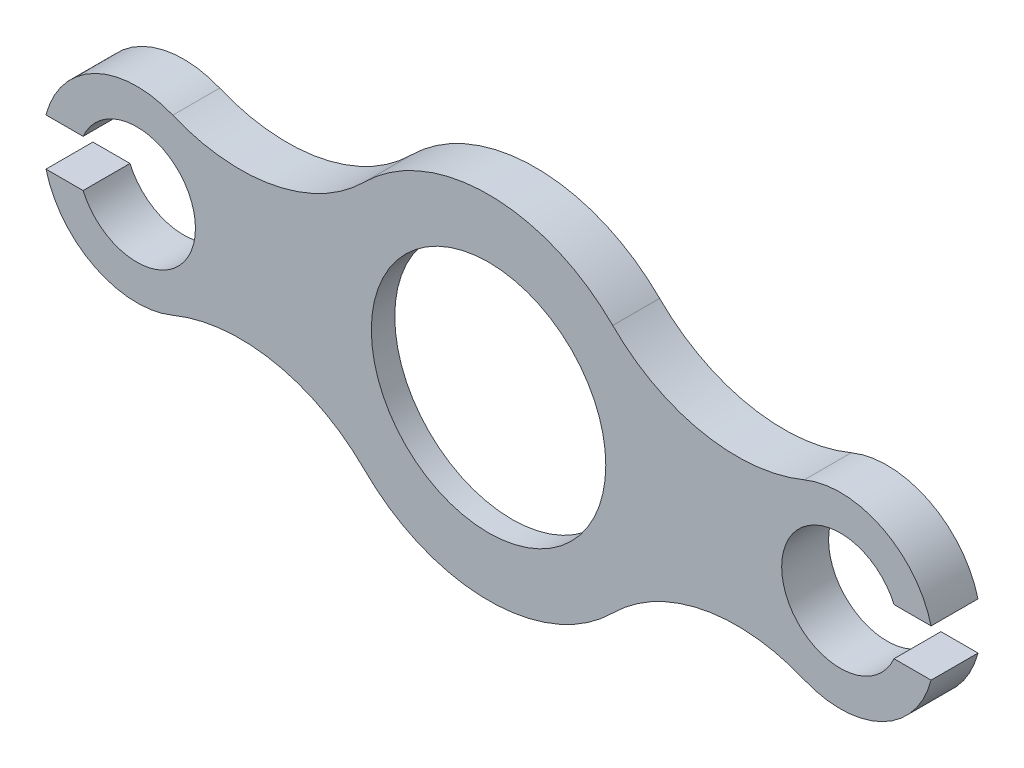
from build123d import *

# Parameters (mm, degrees)
ESQUISSE1_R             = 50
BOSS_EXTRU_3_DEPTH      = 20
ESQUISSE2_R             = 68.25
ENL_V_MAT_EXTRU_9_DEPTH = 10


with BuildPart() as part:
    # Esquisse1 → Boss.-Extru.3 (new body)
    with BuildSketch(Plane.XY):
        with BuildLine():
            ThreePointArc((52.958333333, 53.107578843), (28.652500648, 69.311140566), (0, 75))
            ThreePointArc((0, 75), (-28.652500648, 69.311140566), (-52.958333333, 53.107578843))
            ThreePointArc((-52.958333333, 53.107578843), (-91.362529225, 32.640861336), (-134.666666667, 36.944402673))
            ThreePointArc((-134.666666667, 36.944402673), (-167.842344673, 35.800149952), (-188.729833462, 10))
            Line((-188.729833462, 10), (-172.912878475, 10))
            ThreePointArc((-172.912878475, 10), (-125, 0), (-172.912878475, -10))
            Line((-172.912878475, -10), (-188.729833462, -10))
            ThreePointArc((-188.729833462, -10), (-167.842344673, -35.800149952), (-134.666666667, -36.944402673))
            ThreePointArc((-134.666666667, -36.944402673), (-91.362529225, -32.640861336), (-52.958333333, -53.107578843))
            ThreePointArc((-52.958333333, -53.107578843), (0, -75), (52.958333333, -53.107578843))
            ThreePointArc((52.958333333, -53.107578843), (91.362529225, -32.640861336), (134.666666667, -36.944402673))
            ThreePointArc((134.666666667, -36.944402673), (167.842344673, -35.800149952), (188.729833462, -10))
            Line((188.729833462, -10), (172.912878475, -10))
            ThreePointArc((172.912878475, -10), (125, 0), (172.912878475, 10))
            Line((172.912878475, 10), (188.729833462, 10))
            ThreePointArc((188.729833462, 10), (167.842344673, 35.800149952), (134.666666667, 36.944402673))
            ThreePointArc((134.666666667, 36.944402673), (91.362529225, 32.640861336), (52.958333333, 53.107578843))
        make_face()
        Circle(ESQUISSE1_R, mode=Mode.SUBTRACT)
    extrude(amount=BOSS_EXTRU_3_DEPTH)

    # Esquisse2 → Enlèv. mat.-Extru.9 (cut)
    with BuildSketch(Plane.XY):
        Circle(ESQUISSE2_R)
    extrude(amount=ENL_V_MAT_EXTRU_9_DEPTH, mode=Mode.SUBTRACT)


solid = part.part
